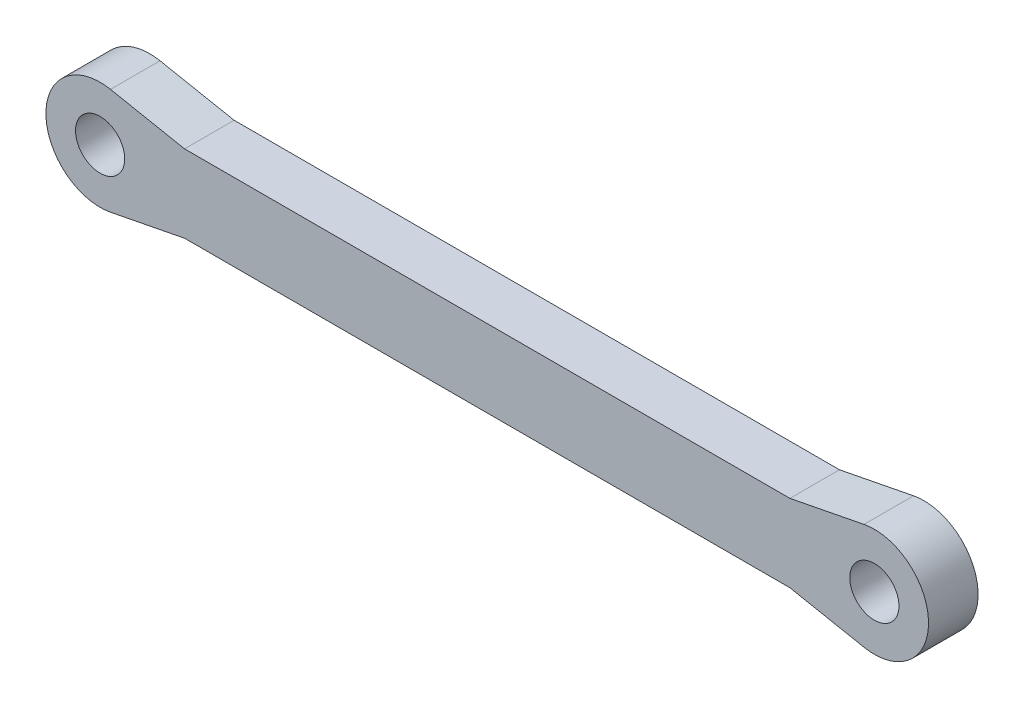
from build123d import *

# Parameters (mm, degrees)
SKETCH1_R           = 1.5875
BOSS_EXTRUDE1_DEPTH = 1.6


with BuildPart() as part:
    # Sketch1 → Boss-Extrude1 (new, symmetric)
    with BuildSketch(Plane.XY):
        with BuildLine():
            Line((19.545643943, -2.5), (-19.545643943, -2.5))
            Line((-19.545643943, -2.5), (-24.328510099, -3.434981996))
            ThreePointArc((-24.328510099, -3.434981996), (-28.5, 0), (-24.328510099, 3.434981996))
            Line((-24.328510099, 3.434981996), (-19.545643943, 2.5))
            Line((-19.545643943, 2.5), (19.545643943, 2.5))
            Line((19.545643943, 2.5), (24.328510099, 3.434981996))
            ThreePointArc((24.328510099, 3.434981996), (28.5, 0), (24.328510099, -3.434981996))
            Line((24.328510099, -3.434981996), (19.545643943, -2.5))
        make_face()
        with Locations((-25, 0)):
            Circle(SKETCH1_R, mode=Mode.SUBTRACT)
        with Locations((25, 0)):
            Circle(SKETCH1_R, mode=Mode.SUBTRACT)
    extrude(amount=BOSS_EXTRUDE1_DEPTH, both=True)


solid = part.part
